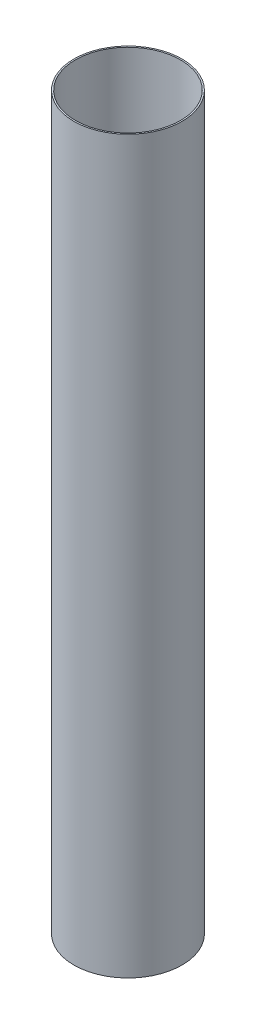
from build123d import *

# Parameters (mm, degrees)
SKETCH1_R           = 51.95
SKETCH1_R_2         = 50.5
BOSS_EXTRUDE1_DEPTH = 702


with BuildPart() as part:
    # Sketch1 → Boss-Extrude1 (new body)
    with BuildSketch(Plane(origin=(0, 0, 0), x_dir=(1, 0, 0), z_dir=(0, 1, 0))):
        with Locations(Location((0, 0, 0), (0, 0, 270))):
            Circle(SKETCH1_R)
        with Locations(Location((0, 0, 0), (0, 0, 270))):
            Circle(SKETCH1_R_2, mode=Mode.SUBTRACT)
    extrude(amount=BOSS_EXTRUDE1_DEPTH)


solid = part.part
